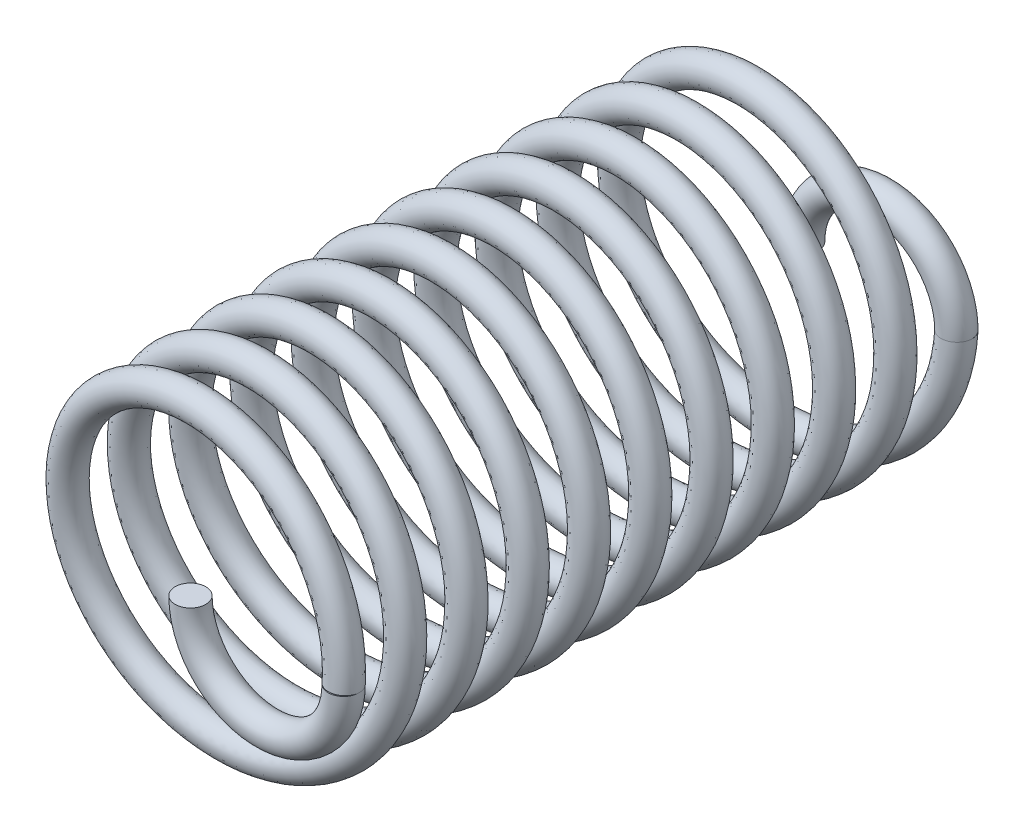
from build123d import *

# Parameters (mm, degrees)
SWEEP_1_PROFILE_R = 5
SWEEP_2_PITCH     = 20
SWEEP_2_HEIGHT    = 200
SWEEP_2_RADIUS    = 50
SWEEP_2_PROFILE_R = 5
SWEEP_3_PROFILE_R = 5


with BuildPart() as part:
    # ｽｲｰﾌﾟ1: sweep along a path in ｽｹｯﾁ4
    with BuildLine(Plane.XY.offset(200)) as sweep_1_path:
        ThreePointArc((0, 0), (25, -25), (50, 0))
    # ｽｲｰﾌﾟ1 profile (on start of the path) → ｽｲｰﾌﾟ1 (sweep)
    with BuildSketch(Plane(origin=(0, 0, 200), x_dir=(-1, 0, 0), z_dir=(0, -1, 0))):
        Circle(SWEEP_1_PROFILE_R)
    sweep(path=sweep_1_path.line)

    # ｽｲｰﾌﾟ2: sweep along a helix
    with BuildLine() as sweep_2_path:
        Helix(SWEEP_2_PITCH, SWEEP_2_HEIGHT, SWEEP_2_RADIUS, center=(0, 0, 0), direction=(0, 0, 1), lefthand=True)
    # ｽｲｰﾌﾟ2 profile (on start of the path) → ｽｲｰﾌﾟ2 (sweep)
    with BuildSketch(Plane(origin=(50, 0, 0), x_dir=(0, -0.06353336191093698, -0.9979797151867837), z_dir=(9.954220530640626e-14, -0.9979797151867837, 0.06353336191093698))):
        Circle(SWEEP_2_PROFILE_R)
    sweep(path=sweep_2_path.line, is_frenet=True)

    # ｽｲｰﾌﾟ3: sweep along a path in ｽｹｯﾁ3
    with BuildLine(Plane.XY) as sweep_3_path:
        ThreePointArc((0, 0), (25, 25), (50, 0))
    # ｽｲｰﾌﾟ3 profile (on start of the path) → ｽｲｰﾌﾟ3 (sweep)
    with BuildSketch(Plane(origin=(0, 0, 0), x_dir=(1, 0, 0), z_dir=(0, 1, 0))):
        Circle(SWEEP_3_PROFILE_R)
    sweep(path=sweep_3_path.line)


solid = part.part
